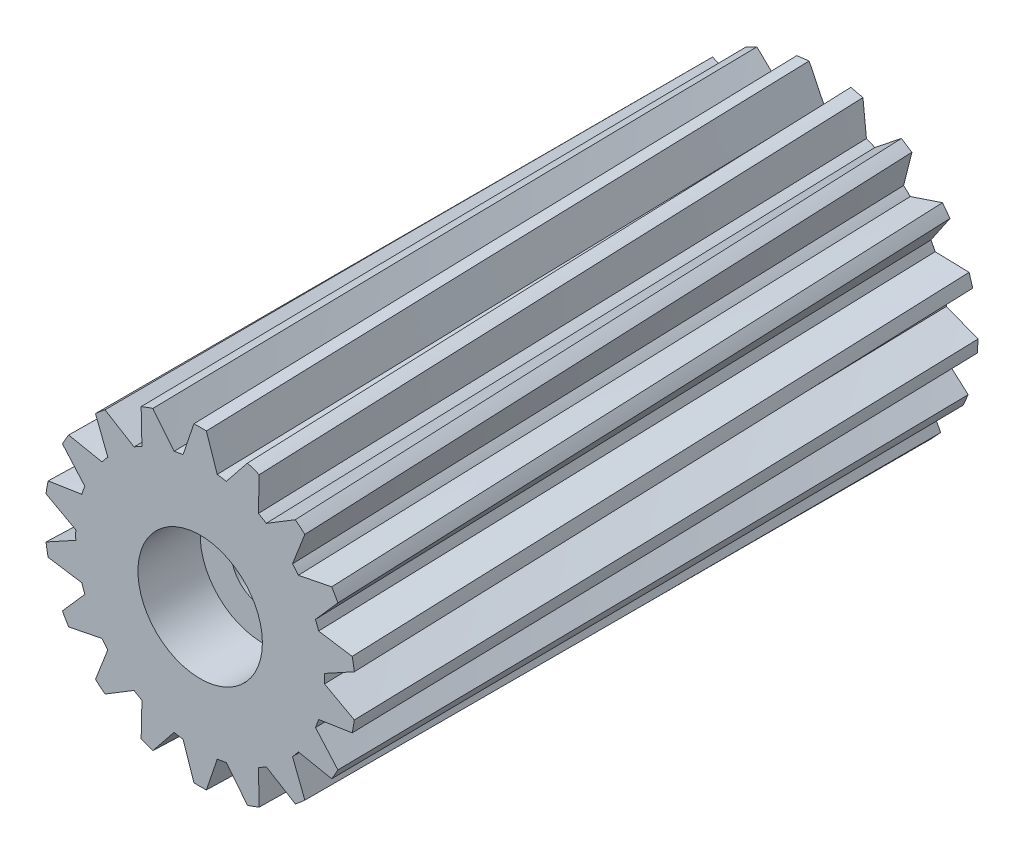
from build123d import *

# Parameters (mm, degrees)
SKETCH1_R           = 20
BOSS_EXTRUDE1_DEPTH = 100
SKETCH2_R           = 10
CUT_EXTRUDE1_DEPTH  = 10
SKETCH6_R           = 5
CUT_EXTRUDE3_DEPTH  = 108.354552768
SWEEP1_PITCH        = 5000
SWEEP1_HEIGHT       = 100
SWEEP1_RADIUS       = 20
SWEEP1_START_ANGLE  = 90
CIRPATTERN1_COUNT   = 18


with BuildPart() as part:
    # Sketch1 → Boss-Extrude1 (new body)
    with BuildSketch(Plane.XY):
        with Locations((0, 35)):
            Circle(SKETCH1_R)
    extrude(amount=-BOSS_EXTRUDE1_DEPTH)

    # Sketch2 → Cut-Extrude1 (cut)
    with BuildSketch(Plane.XY):
        with Locations((0, 35)):
            Circle(SKETCH2_R)
    extrude(amount=-CUT_EXTRUDE1_DEPTH, mode=Mode.SUBTRACT)

    # Sketch6 → Cut-Extrude3 (cut, through all)
    with BuildSketch(Plane.XY.offset(-10)):
        with Locations((0, 35)):
            Circle(SKETCH6_R)
    extrude(amount=-CUT_EXTRUDE3_DEPTH, mode=Mode.SUBTRACT)

    # Sweep1: sweep along a helix
    with BuildLine() as sweep1_path:
        add(Helix(SWEEP1_PITCH, SWEEP1_HEIGHT, SWEEP1_RADIUS, center=(0, 35, 0), direction=(0, 0, -1), lefthand=True, mode=Mode.PRIVATE).rotate(Axis((0, 35, 0), (0, 0, -1)), SWEEP1_START_ANGLE))
    # Sketch7 → Sweep1 (sweep)
    with BuildSketch(Plane.XY):
        with BuildLine():
            Line((1, 10.020008006), (2.75, 15.189964664))
            ThreePointArc((2.75, 15.189964664), (0, 15), (-2.75, 15.189964664))
            Line((-2.75, 15.189964664), (-1, 10.020008006))
            ThreePointArc((-1, 10.020008006), (0, 10), (1, 10.020008006))
        make_face()
    sweep1 = sweep(path=sweep1_path.line, is_frenet=True)

    # CirPattern1: Sweep1 ×18 about axis
    cirpattern1_axis = Axis((0, 35, -10), (0, 0, 1))
    for i in range(1, CIRPATTERN1_COUNT):
        add(sweep1.rotate(cirpattern1_axis, i * 360 / CIRPATTERN1_COUNT))


solid = part.part
